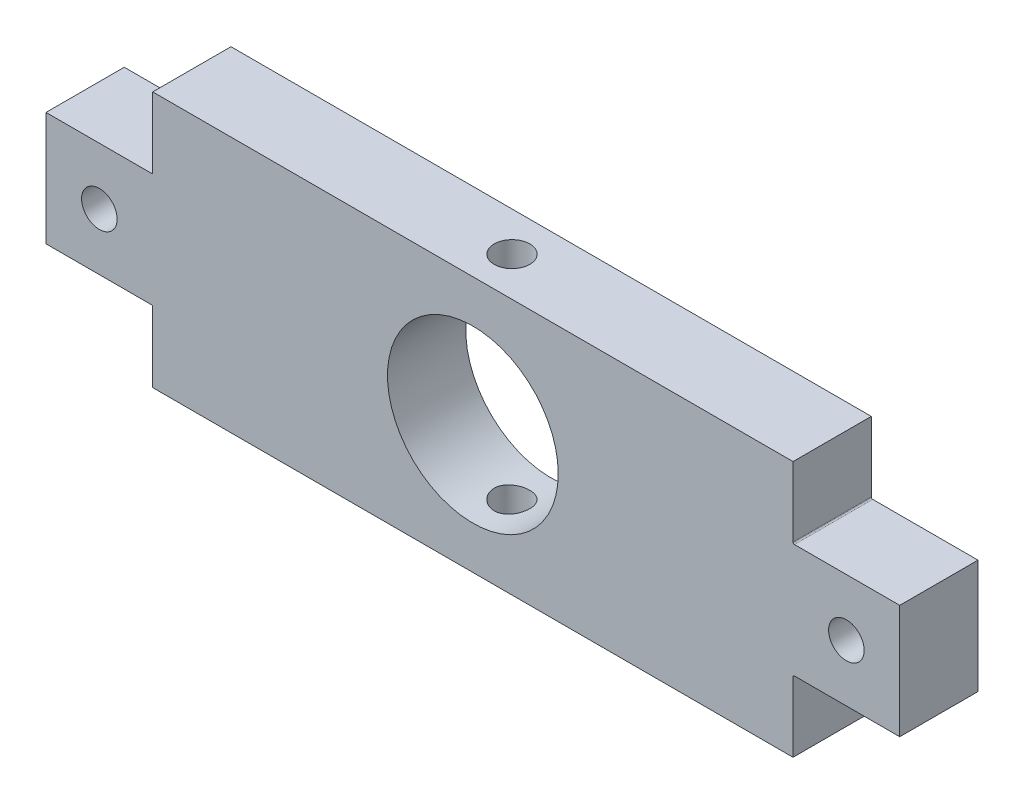
from build123d import *

# Parameters (mm, degrees)
ESTRUSIONE_ESTRUSIONE1_DEPTH = 11
SCHIZZO4_R                   = 12
TAGLIO_ESTRUSIONE1_DEPTH     = 64.600314465
FORO_5_0_5_1_D               = 5
FORO_5_0_5_2_D               = 5
RACCORDO1_R                  = 0.2


with BuildPart() as part:
    # Schizzo2 → Estrusione-Estrusione1 (new body)
    with BuildSketch(Plane(origin=(0, 0, 0), x_dir=(1, 0, 0), z_dir=(0, 0, -1))):
        Polygon((-60, -8), (-60, 8), (-45, 8), (-45, 18), (45, 18), (45, 8), (60, 8), (60, -8), (45, -8), (45, -18), (-45, -18), (-45, -8), align=None)
    extrude(amount=-ESTRUSIONE_ESTRUSIONE1_DEPTH)

    # Schizzo4 → Taglio-Estrusione1 (cut, through all)
    with BuildSketch(Plane.XY.offset(11)):
        Circle(SCHIZZO4_R)
    extrude(amount=-TAGLIO_ESTRUSIONE1_DEPTH, mode=Mode.SUBTRACT)

    # Foro Ø5.0 (5)-1 (through all)
    with Locations(Plane(origin=(0, -18, 0), x_dir=(-1, 0, 0), z_dir=(0, -1, 0))):
        with Locations((0, -5.5)):
            Hole(FORO_5_0_5_1_D / 2)

    # Foro Ø5.0 (5)-2 (through all)
    with Locations(Plane.XY.offset(11)):
        with Locations((-52.5, 0), (52.5, 0)):
            Hole(FORO_5_0_5_2_D / 2)

    # Raccordo1
    raccordo1_edges = [part.edges().sort_by_distance(p)[0] for p in [
        (45, -8, 5.5),
        (45, 8, 5.5),
        (-45, 8, 5.5),
        (-45, -8, 5.5),
    ]]
    fillet(raccordo1_edges, radius=RACCORDO1_R)


solid = part.part
